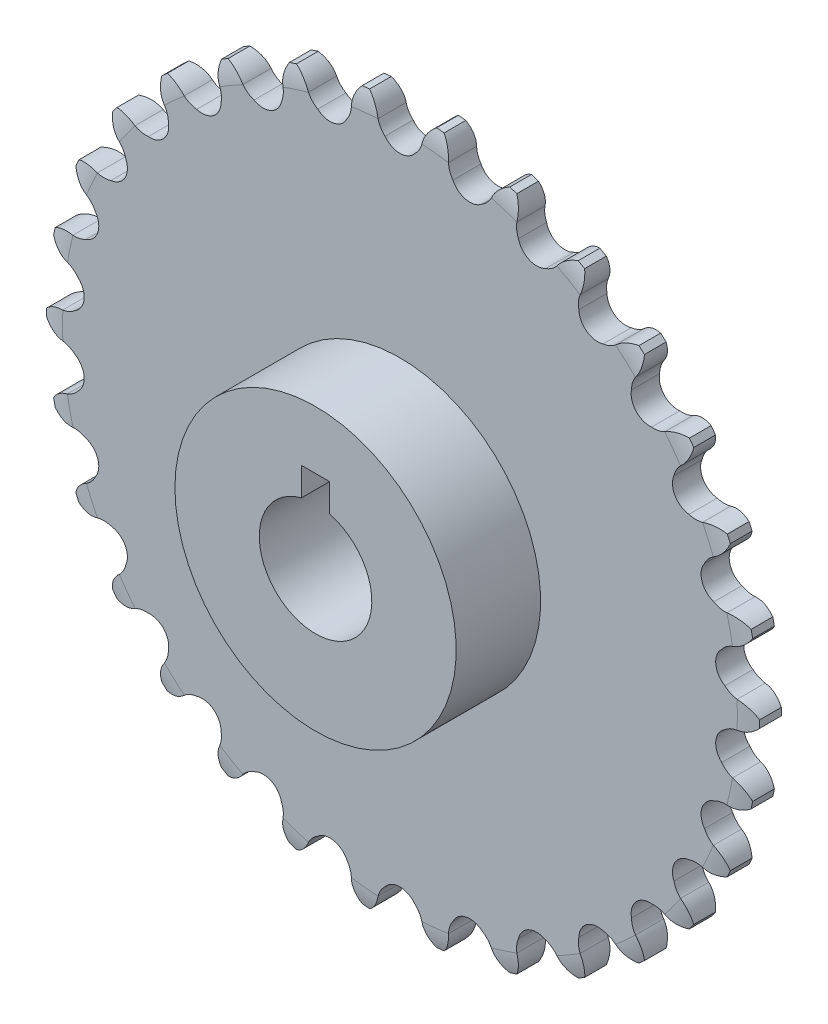
from build123d import *

# Parameters (mm, degrees)
BOSS_EXTRUDE1_DEPTH     = 1.27
SKETCH2_R               = 12.7
BOSS_EXTRUDE2_DEPTH     = 7.62
CUT_EXTRUDE1_DEPTH      = 47.87812298
CUT_EXTRUDE2_DEPTH      = 47.39393524
CUT_EXTRUDE2_DEPTH_BACK = 47.39393524
SKETCH5_OUTSIDE_W       = 85.316
SKETCH5_OUTSIDE_H       = 84.96
SKETCH5_OUTSIDE_R       = 32.194707316


with BuildPart() as part:
    # Sketch1 → Boss-Extrude1 (new, symmetric)
    with BuildSketch(Plane.XY):
        with BuildLine():
            ThreePointArc((-1.980236681, 30.405161671), (-1.743258369, 29.834131357), (-1.354812472, 29.353148899))
            ThreePointArc((-1.354812472, 29.353148899), (0, 28.67787), (1.354812472, 29.353148899))
            ThreePointArc((1.354812472, 29.353148899), (1.743258369, 29.834131357), (1.980236681, 30.405161671))
            ThreePointArc((1.980236681, 30.405161671), (2.470513672, 31.501102658), (3.391813511, 32.270949902))
            ThreePointArc((3.391813511, 32.270949902), (4.132920496, 31.32637666), (4.384624814, 30.152450295))
            ThreePointArc((4.384624814, 30.152450295), (4.497700703, 29.544627802), (4.777656249, 28.993393521))
            ThreePointArc((4.777656249, 28.993393521), (5.962464441, 28.051189735), (7.428069388, 28.430030817))
            ThreePointArc((7.428069388, 28.430030817), (7.908028686, 28.819740212), (8.258552331, 29.329021582))
            ThreePointArc((8.258552331, 29.329021582), (8.965974537, 30.299079311), (10.027202006, 30.860554538))
            ThreePointArc((10.027202006, 30.860554538), (10.555726206, 29.782537681), (10.557857165, 28.581932154))
            ThreePointArc((10.557857165, 28.581932154), (10.542088673, 27.963882241), (10.701318467, 27.366487721))
            ThreePointArc((10.701318467, 27.366487721), (11.664340574, 26.198537873), (13.176684027, 26.264383967))
            ThreePointArc((13.176684027, 26.264383967), (13.727180202, 26.545788127), (14.175929616, 26.971062513))
            ThreePointArc((14.175929616, 26.971062513), (15.069579291, 27.772840806), (16.224353658, 28.101404856))
            ThreePointArc((16.224353658, 28.101404856), (16.517196028, 26.937058894), (16.269660496, 25.762246426))
            ThreePointArc((16.269660496, 25.762246426), (16.12573678, 25.160980841), (16.157281717, 24.543535088))
            ThreePointArc((16.157281717, 24.543535088), (16.856429053, 23.200884192), (18.349414345, 22.950857507))
            ThreePointArc((18.349414345, 22.950857507), (18.946388073, 23.11165772), (19.473750752, 23.434338591))
            ThreePointArc((19.473750752, 23.434338591), (20.514571118, 24.03279589), (21.712423202, 24.114088935))
            ThreePointArc((21.712423202, 24.114088935), (21.756785126, 22.914301374), (21.270401592, 21.816626908))
            ThreePointArc((21.270401592, 21.816626908), (21.004612811, 21.258423842), (20.907094224, 20.647912199))
            ThreePointArc((20.907094224, 20.647912199), (21.311810696, 19.189240542), (22.720187207, 18.634268443))
            ThreePointArc((22.720187207, 18.634268443), (23.33754787, 18.667436969), (23.920475535, 18.873421622))
            ThreePointArc((23.920475535, 18.873421622), (25.062977748, 19.242402471), (26.251555664, 19.072871616))
            ThreePointArc((26.251555664, 19.072871616), (26.045498313, 17.890078929), (25.341524073, 16.917516107))
            ThreePointArc((25.341524073, 16.917516107), (24.96548647, 16.426771712), (24.743166391, 15.849876468))
            ThreePointArc((24.743166391, 15.849876468), (24.835763946, 14.338935), (26.097978863, 13.503272431))
            ThreePointArc((26.097978863, 13.503272431), (26.70874484, 13.407359645), (27.321760754, 13.487645564))
            ThreePointArc((27.321760754, 13.487645564), (28.516011985, 13.611023729), (29.643369175, 13.198078286))
            ThreePointArc((29.643369175, 13.198078286), (29.195898244, 12.083974189), (28.305100349, 11.279028673))
            ThreePointArc((28.305100349, 11.279028673), (27.835248573, 10.877190833), (27.497843456, 10.359125078))
            ThreePointArc((27.497843456, 10.359125078), (27.274275137, 8.861949192), (28.335163612, 7.782118618))
            ThreePointArc((28.335163612, 7.782118618), (28.912641497, 7.56131637), (29.528953924, 7.512394673))
            ThreePointArc((29.528953924, 7.512394673), (30.722759663, 7.384777937), (31.739625208, 6.746465603))
            ThreePointArc((31.739625208, 6.746465603), (31.070297324, 5.749741791), (30.031607917, 5.147593563))
            ThreePointArc((30.031607917, 5.147593563), (29.488476745, 4.852224521), (29.050732812, 4.415630214))
            ThreePointArc((29.050732812, 4.415630214), (28.520769628, 2.997653681), (29.333965743, 1.720848879))
            ThreePointArc((29.333965743, 1.720848879), (29.852916982, 1.384807286), (30.445590111, 1.208816087))
            ThreePointArc((30.445590111, 1.208816087), (31.586775319, 0.835781913), (32.448707316, 0))
            ThreePointArc((32.448707316, 0), (31.586775319, -0.835781913), (30.445590111, -1.208816087))
            ThreePointArc((30.445590111, -1.208816087), (29.852916982, -1.384807286), (29.333965743, -1.720848879))
            ThreePointArc((29.333965743, -1.720848879), (28.520769628, -2.997653681), (29.050732812, -4.415630214))
            ThreePointArc((29.050732812, -4.415630214), (29.488476745, -4.852224521), (30.031607917, -5.147593563))
            ThreePointArc((30.031607917, -5.147593563), (31.070297324, -5.749741791), (31.739625208, -6.746465603))
            ThreePointArc((31.739625208, -6.746465603), (30.722759663, -7.384777937), (29.528953924, -7.512394673))
            ThreePointArc((29.528953924, -7.512394673), (28.912641497, -7.56131637), (28.335163612, -7.782118618))
            ThreePointArc((28.335163612, -7.782118618), (27.274275137, -8.861949192), (27.497843456, -10.359125078))
            ThreePointArc((27.497843456, -10.359125078), (27.835248573, -10.877190833), (28.305100349, -11.279028673))
            ThreePointArc((28.305100349, -11.279028673), (29.195898244, -12.083974189), (29.643369175, -13.198078286))
            ThreePointArc((29.643369175, -13.198078286), (28.516011985, -13.611023729), (27.321760754, -13.487645564))
            ThreePointArc((27.321760754, -13.487645564), (26.70874484, -13.407359645), (26.097978863, -13.503272431))
            ThreePointArc((26.097978863, -13.503272431), (24.835763946, -14.338935), (24.743166391, -15.849876468))
            ThreePointArc((24.743166391, -15.849876468), (24.96548647, -16.426771712), (25.341524073, -16.917516107))
            ThreePointArc((25.341524073, -16.917516107), (26.045498313, -17.890078929), (26.251555664, -19.072871616))
            ThreePointArc((26.251555664, -19.072871616), (25.062977748, -19.242402471), (23.920475535, -18.873421622))
            ThreePointArc((23.920475535, -18.873421622), (23.33754787, -18.667436969), (22.720187207, -18.634268443))
            ThreePointArc((22.720187207, -18.634268443), (21.311810696, -19.189240542), (20.907094224, -20.647912199))
            ThreePointArc((20.907094224, -20.647912199), (21.004612811, -21.258423842), (21.270401592, -21.816626908))
            ThreePointArc((21.270401592, -21.816626908), (21.756785126, -22.914301374), (21.712423202, -24.114088935))
            ThreePointArc((21.712423202, -24.114088935), (20.514571118, -24.03279589), (19.473750752, -23.434338591))
            ThreePointArc((19.473750752, -23.434338591), (18.946388073, -23.11165772), (18.349414345, -22.950857507))
            ThreePointArc((18.349414345, -22.950857507), (16.856429053, -23.200884192), (16.157281717, -24.543535088))
            ThreePointArc((16.157281717, -24.543535088), (16.12573678, -25.160980841), (16.269660496, -25.762246426))
            ThreePointArc((16.269660496, -25.762246426), (16.517196028, -26.937058894), (16.224353658, -28.101404856))
            ThreePointArc((16.224353658, -28.101404856), (15.069579291, -27.772840806), (14.175929616, -26.971062513))
            ThreePointArc((14.175929616, -26.971062513), (13.727180202, -26.545788127), (13.176684027, -26.264383967))
            ThreePointArc((13.176684027, -26.264383967), (11.664340574, -26.198537873), (10.701318467, -27.366487721))
            ThreePointArc((10.701318467, -27.366487721), (10.542088673, -27.963882241), (10.557857165, -28.581932154))
            ThreePointArc((10.557857165, -28.581932154), (10.555726206, -29.782537681), (10.027202006, -30.860554538))
            ThreePointArc((10.027202006, -30.860554538), (8.965974537, -30.299079311), (8.258552331, -29.329021582))
            ThreePointArc((8.258552331, -29.329021582), (7.908028686, -28.819740212), (7.428069388, -28.430030817))
            ThreePointArc((7.428069388, -28.430030817), (5.962464441, -28.051189735), (4.777656249, -28.993393521))
            ThreePointArc((4.777656249, -28.993393521), (4.497700703, -29.544627802), (4.384624814, -30.152450295))
            ThreePointArc((4.384624814, -30.152450295), (4.132920496, -31.32637666), (3.391813511, -32.270949902))
            ThreePointArc((3.391813511, -32.270949902), (2.470513672, -31.501102658), (1.980236681, -30.405161671))
            ThreePointArc((1.980236681, -30.405161671), (1.743258369, -29.834131357), (1.354812472, -29.353148899))
            ThreePointArc((1.354812472, -29.353148899), (0, -28.67787), (-1.354812472, -29.353148899))
            ThreePointArc((-1.354812472, -29.353148899), (-1.743258369, -29.834131357), (-1.980236681, -30.405161671))
            ThreePointArc((-1.980236681, -30.405161671), (-2.470513672, -31.501102658), (-3.391813511, -32.270949902))
            ThreePointArc((-3.391813511, -32.270949902), (-4.132920496, -31.32637666), (-4.384624814, -30.152450295))
            ThreePointArc((-4.384624814, -30.152450295), (-4.497700703, -29.544627802), (-4.777656249, -28.993393521))
            ThreePointArc((-4.777656249, -28.993393521), (-5.962464441, -28.051189735), (-7.428069388, -28.430030817))
            ThreePointArc((-7.428069388, -28.430030817), (-7.908028686, -28.819740212), (-8.258552331, -29.329021582))
            ThreePointArc((-8.258552331, -29.329021582), (-8.965974537, -30.299079311), (-10.027202006, -30.860554538))
            ThreePointArc((-10.027202006, -30.860554538), (-10.555726206, -29.782537681), (-10.557857165, -28.581932154))
            ThreePointArc((-10.557857165, -28.581932154), (-10.542088673, -27.963882241), (-10.701318467, -27.366487721))
            ThreePointArc((-10.701318467, -27.366487721), (-11.664340574, -26.198537873), (-13.176684027, -26.264383967))
            ThreePointArc((-13.176684027, -26.264383967), (-13.727180202, -26.545788127), (-14.175929616, -26.971062513))
            ThreePointArc((-14.175929616, -26.971062513), (-15.069579291, -27.772840806), (-16.224353658, -28.101404856))
            ThreePointArc((-16.224353658, -28.101404856), (-16.517196028, -26.937058894), (-16.269660496, -25.762246426))
            ThreePointArc((-16.269660496, -25.762246426), (-16.12573678, -25.160980841), (-16.157281717, -24.543535088))
            ThreePointArc((-16.157281717, -24.543535088), (-16.856429053, -23.200884192), (-18.349414345, -22.950857507))
            ThreePointArc((-18.349414345, -22.950857507), (-18.946388073, -23.11165772), (-19.473750752, -23.434338591))
            ThreePointArc((-19.473750752, -23.434338591), (-20.514571118, -24.03279589), (-21.712423202, -24.114088935))
            ThreePointArc((-21.712423202, -24.114088935), (-21.756785126, -22.914301374), (-21.270401592, -21.816626908))
            ThreePointArc((-21.270401592, -21.816626908), (-21.004612811, -21.258423842), (-20.907094224, -20.647912199))
            ThreePointArc((-20.907094224, -20.647912199), (-21.311810696, -19.189240542), (-22.720187207, -18.634268443))
            ThreePointArc((-22.720187207, -18.634268443), (-23.33754787, -18.667436969), (-23.920475535, -18.873421622))
            ThreePointArc((-23.920475535, -18.873421622), (-25.062977748, -19.242402471), (-26.251555664, -19.072871616))
            ThreePointArc((-26.251555664, -19.072871616), (-26.045498313, -17.890078929), (-25.341524073, -16.917516107))
            ThreePointArc((-25.341524073, -16.917516107), (-24.96548647, -16.426771712), (-24.743166391, -15.849876468))
            ThreePointArc((-24.743166391, -15.849876468), (-24.835763946, -14.338935), (-26.097978863, -13.503272431))
            ThreePointArc((-26.097978863, -13.503272431), (-26.70874484, -13.407359645), (-27.321760754, -13.487645564))
            ThreePointArc((-27.321760754, -13.487645564), (-28.516011985, -13.611023729), (-29.643369175, -13.198078286))
            ThreePointArc((-29.643369175, -13.198078286), (-29.195898244, -12.083974189), (-28.305100349, -11.279028673))
            ThreePointArc((-28.305100349, -11.279028673), (-27.835248573, -10.877190833), (-27.497843456, -10.359125078))
            ThreePointArc((-27.497843456, -10.359125078), (-27.274275137, -8.861949192), (-28.335163612, -7.782118618))
            ThreePointArc((-28.335163612, -7.782118618), (-28.912641497, -7.56131637), (-29.528953924, -7.512394673))
            ThreePointArc((-29.528953924, -7.512394673), (-30.722759663, -7.384777937), (-31.739625208, -6.746465603))
            ThreePointArc((-31.739625208, -6.746465603), (-31.070297324, -5.749741791), (-30.031607917, -5.147593563))
            ThreePointArc((-30.031607917, -5.147593563), (-29.488476745, -4.852224521), (-29.050732812, -4.415630214))
            ThreePointArc((-29.050732812, -4.415630214), (-28.520769628, -2.997653681), (-29.333965743, -1.720848879))
            ThreePointArc((-29.333965743, -1.720848879), (-29.852916982, -1.384807286), (-30.445590111, -1.208816087))
            ThreePointArc((-30.445590111, -1.208816087), (-31.586775319, -0.835781913), (-32.448707316, 0))
            ThreePointArc((-32.448707316, 0), (-31.586775319, 0.835781913), (-30.445590111, 1.208816087))
            ThreePointArc((-30.445590111, 1.208816087), (-29.852916982, 1.384807286), (-29.333965743, 1.720848879))
            ThreePointArc((-29.333965743, 1.720848879), (-28.520769628, 2.997653681), (-29.050732812, 4.415630214))
            ThreePointArc((-29.050732812, 4.415630214), (-29.488476745, 4.852224521), (-30.031607917, 5.147593563))
            ThreePointArc((-30.031607917, 5.147593563), (-31.070297324, 5.749741791), (-31.739625208, 6.746465603))
            ThreePointArc((-31.739625208, 6.746465603), (-30.722759663, 7.384777937), (-29.528953924, 7.512394673))
            ThreePointArc((-29.528953924, 7.512394673), (-28.912641497, 7.56131637), (-28.335163612, 7.782118618))
            ThreePointArc((-28.335163612, 7.782118618), (-27.274275137, 8.861949192), (-27.497843456, 10.359125078))
            ThreePointArc((-27.497843456, 10.359125078), (-27.835248573, 10.877190833), (-28.305100349, 11.279028673))
            ThreePointArc((-28.305100349, 11.279028673), (-29.195898244, 12.083974189), (-29.643369175, 13.198078286))
            ThreePointArc((-29.643369175, 13.198078286), (-28.516011985, 13.611023729), (-27.321760754, 13.487645564))
            ThreePointArc((-27.321760754, 13.487645564), (-26.70874484, 13.407359645), (-26.097978863, 13.503272431))
            ThreePointArc((-26.097978863, 13.503272431), (-24.835763946, 14.338935), (-24.743166391, 15.849876468))
            ThreePointArc((-24.743166391, 15.849876468), (-24.96548647, 16.426771712), (-25.341524073, 16.917516107))
            ThreePointArc((-25.341524073, 16.917516107), (-26.045498313, 17.890078929), (-26.251555664, 19.072871616))
            ThreePointArc((-26.251555664, 19.072871616), (-25.062977748, 19.242402471), (-23.920475535, 18.873421622))
            ThreePointArc((-23.920475535, 18.873421622), (-23.33754787, 18.667436969), (-22.720187207, 18.634268443))
            ThreePointArc((-22.720187207, 18.634268443), (-21.311810696, 19.189240542), (-20.907094224, 20.647912199))
            ThreePointArc((-20.907094224, 20.647912199), (-21.004612811, 21.258423842), (-21.270401592, 21.816626908))
            ThreePointArc((-21.270401592, 21.816626908), (-21.756785126, 22.914301374), (-21.712423202, 24.114088935))
            ThreePointArc((-21.712423202, 24.114088935), (-20.514571118, 24.03279589), (-19.473750752, 23.434338591))
            ThreePointArc((-19.473750752, 23.434338591), (-18.946388073, 23.11165772), (-18.349414345, 22.950857507))
            ThreePointArc((-18.349414345, 22.950857507), (-16.856429053, 23.200884192), (-16.157281717, 24.543535088))
            ThreePointArc((-16.157281717, 24.543535088), (-16.12573678, 25.160980841), (-16.269660496, 25.762246426))
            ThreePointArc((-16.269660496, 25.762246426), (-16.517196028, 26.937058894), (-16.224353658, 28.101404856))
            ThreePointArc((-16.224353658, 28.101404856), (-15.069579291, 27.772840806), (-14.175929616, 26.971062513))
            ThreePointArc((-14.175929616, 26.971062513), (-13.727180202, 26.545788127), (-13.176684027, 26.264383967))
            ThreePointArc((-13.176684027, 26.264383967), (-11.664340574, 26.198537873), (-10.701318467, 27.366487721))
            ThreePointArc((-10.701318467, 27.366487721), (-10.542088673, 27.963882241), (-10.557857165, 28.581932154))
            ThreePointArc((-10.557857165, 28.581932154), (-10.555726206, 29.782537681), (-10.027202006, 30.860554538))
            ThreePointArc((-10.027202006, 30.860554538), (-8.965974537, 30.299079311), (-8.258552331, 29.329021582))
            ThreePointArc((-8.258552331, 29.329021582), (-7.908028686, 28.819740212), (-7.428069388, 28.430030817))
            ThreePointArc((-7.428069388, 28.430030817), (-5.962464441, 28.051189735), (-4.777656249, 28.993393521))
            ThreePointArc((-4.777656249, 28.993393521), (-4.497700703, 29.544627802), (-4.384624814, 30.152450295))
            ThreePointArc((-4.384624814, 30.152450295), (-4.132920496, 31.32637666), (-3.391813511, 32.270949902))
            ThreePointArc((-3.391813511, 32.270949902), (-2.470513672, 31.501102658), (-1.980236681, 30.405161671))
        make_face()
    extrude(amount=BOSS_EXTRUDE1_DEPTH, both=True)

    # Sketch2 → Boss-Extrude2 (add)
    with BuildSketch(Plane.XY.offset(1.27)):
        with Locations(Location((0, 0, 0), (0, 0, 180))):
            Circle(SKETCH2_R)
    extrude(amount=BOSS_EXTRUDE2_DEPTH)

    # Sketch3 → Cut-Extrude1 (cut, through all)
    with BuildSketch(Plane.XY.offset(8.89)):
        with BuildLine():
            Line((1.27, 4.91868885), (1.27, 7.45868885))
            Line((1.27, 7.45868885), (-1.27, 7.45868885))
            Line((-1.27, 7.45868885), (-1.27, 4.91868885))
            ThreePointArc((-1.27, 4.91868885), (0, -5.08), (1.27, 4.91868885))
        make_face()
    extrude(amount=-CUT_EXTRUDE1_DEPTH, mode=Mode.SUBTRACT)

    # Sketch4 → Cut-Revolve1 (revolve, cut)
    with BuildSketch(Plane(origin=(0, 0, 0), x_dir=(0, 0, -1), z_dir=(1, 0, 0))):
        with BuildLine():
            Line((-1.27, 32.697657815), (-1.27, 30.463016923))
            ThreePointArc((-1.27, 30.463016923), (-1.13540934, 31.601721585), (-0.798234705, 32.697657815))
            Line((-0.798234705, 32.697657815), (-1.27, 32.697657815))
        make_face()
        with BuildLine():
            Line((1.27, 32.697657815), (0.798234705, 32.697657815))
            ThreePointArc((0.798234705, 32.697657815), (1.13540934, 31.601721585), (1.27, 30.463016923))
            Line((1.27, 30.463016923), (1.27, 32.697657815))
        make_face()
    revolve(axis=Axis((0, 0, -1.27), (0, 0, -1)), mode=Mode.SUBTRACT)

    # Sketch5 outside → Cut-Extrude2 (cut, two sides: drawn at the far end of the back side and taken through both)
    with BuildSketch(Plane.XY.offset(1.27).offset(-CUT_EXTRUDE2_DEPTH_BACK)):
        Rectangle(SKETCH5_OUTSIDE_W, SKETCH5_OUTSIDE_H)
        Circle(SKETCH5_OUTSIDE_R, mode=Mode.SUBTRACT)
    extrude(amount=CUT_EXTRUDE2_DEPTH + CUT_EXTRUDE2_DEPTH_BACK, mode=Mode.SUBTRACT)


solid = part.part
